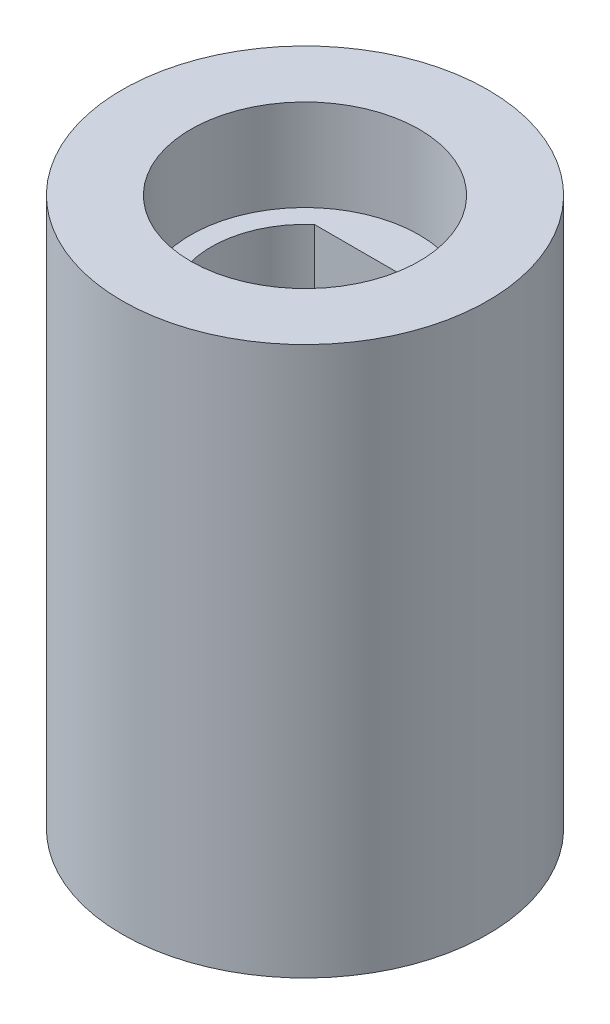
from build123d import *

# Parameters (mm, degrees)
SKETCH1_R           = 4
BOSS_EXTRUDE1_DEPTH = 10
SKETCH2_R           = 4
SKETCH2_R_2         = 2.5
BOSS_EXTRUDE2_DEPTH = 2


with BuildPart() as part:
    # Sketch1 → Boss-Extrude1 (new body)
    with BuildSketch(Plane(origin=(0, 0, 0), x_dir=(1, 0, 0), z_dir=(0, 1, 0))):
        with Locations(Location((0, 0, 0), (0, 0, 270))):
            Circle(SKETCH1_R)
        with BuildLine():
            Line((-1.341640786, 1.55), (1.341640786, 1.55))
            ThreePointArc((1.341640786, 1.55), (0, -2.05), (-1.341640786, 1.55))
        make_face(mode=Mode.SUBTRACT)
    extrude(amount=BOSS_EXTRUDE1_DEPTH)

    # Sketch2 → Boss-Extrude2 (add)
    with BuildSketch(Plane(origin=(0, 10, 0), x_dir=(1, 0, 0), z_dir=(0, 1, 0))):
        with Locations(Location((0, 0, 0), (0, 0, 270))):
            Circle(SKETCH2_R)
        with Locations(Location((0, 0, 0), (0, 0, 270))):
            Circle(SKETCH2_R_2, mode=Mode.SUBTRACT)
    extrude(amount=BOSS_EXTRUDE2_DEPTH)


solid = part.part
